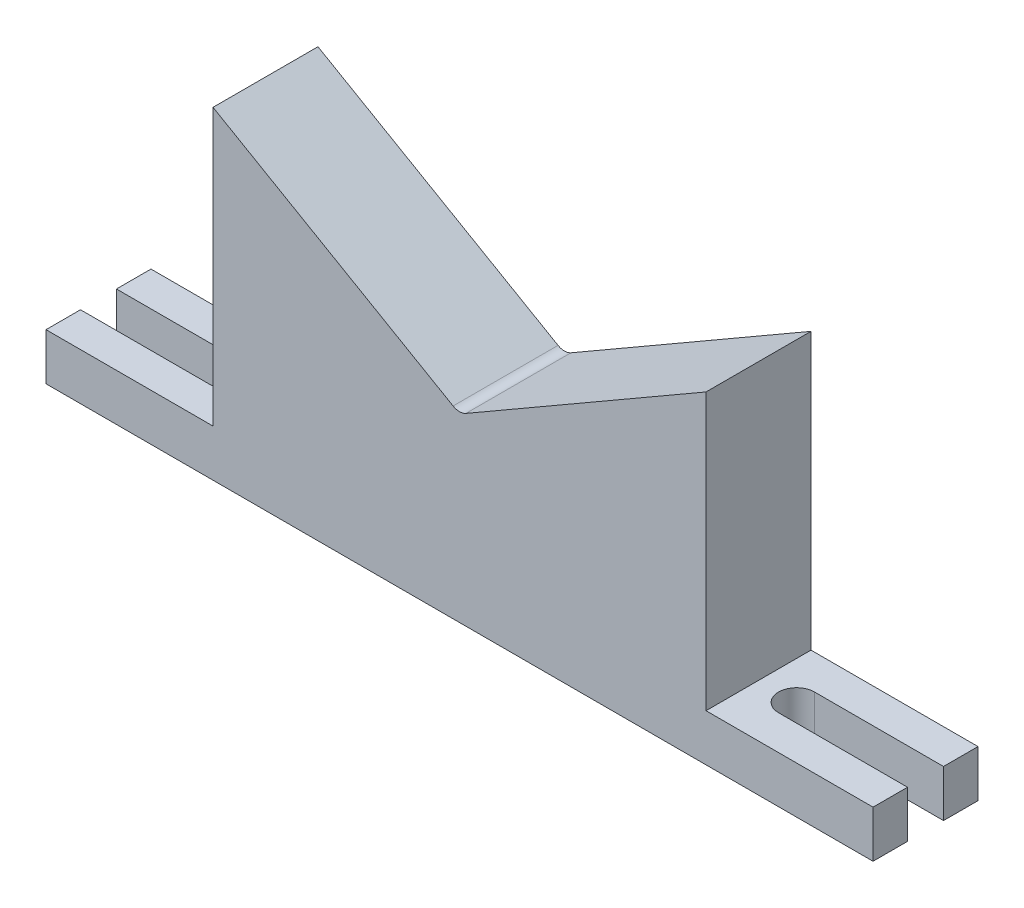
from build123d import *

# Parameters (mm, degrees)
BOSS_EXTRUDE1_DEPTH = 20.7518
CUT_EXTRUDE1_DEPTH  = 10
FILLET1_R           = 2.54


with BuildPart() as part:
    # Sketch1 → Boss-Extrude1 (new body)
    with BuildSketch(Plane.XY):
        Polygon((-48.735, 28.137165369), (0, 0), (48.735, 28.137165369), (48.735, -26.443474646), (81.755, -26.443474646), (81.755, -35.714474646), (81.623037502, -35.714474646), (-81.623037502, -35.714474646), (-81.755, -35.714474646), (-81.755, -26.443474646), (-48.735, -26.443474646), align=None)
    extrude(amount=BOSS_EXTRUDE1_DEPTH)

    # Sketch2 → Cut-Extrude1 (cut)
    with BuildSketch(Plane(origin=(0, -26.443474646, 0), x_dir=(1, 0, 0), z_dir=(0, 1, 0))):
        with BuildLine():
            Line((-56.257083812, -6.8199), (-81.755, -6.8199))
            Line((-81.755, -6.8199), (-81.755, -13.9319))
            Line((-81.755, -13.9319), (-56.257083812, -13.9319))
            ThreePointArc((-56.257083812, -13.9319), (-52.701083812, -10.3759), (-56.257083812, -6.8199))
        make_face()
        with BuildLine():
            Line((81.755, -13.9319), (81.755, -6.8199))
            Line((81.755, -6.8199), (56.257083812, -6.8199))
            ThreePointArc((56.257083812, -6.8199), (52.701083812, -10.3759), (56.257083812, -13.9319))
            Line((56.257083812, -13.9319), (81.755, -13.9319))
        make_face()
    extrude(amount=-CUT_EXTRUDE1_DEPTH, mode=Mode.SUBTRACT)

    # Fillet1
    fillet1_edges = [part.edges().sort_by_distance(p)[0] for p in [
        (0, 0, 10.3759),
    ]]
    fillet(fillet1_edges, radius=FILLET1_R)


solid = part.part
